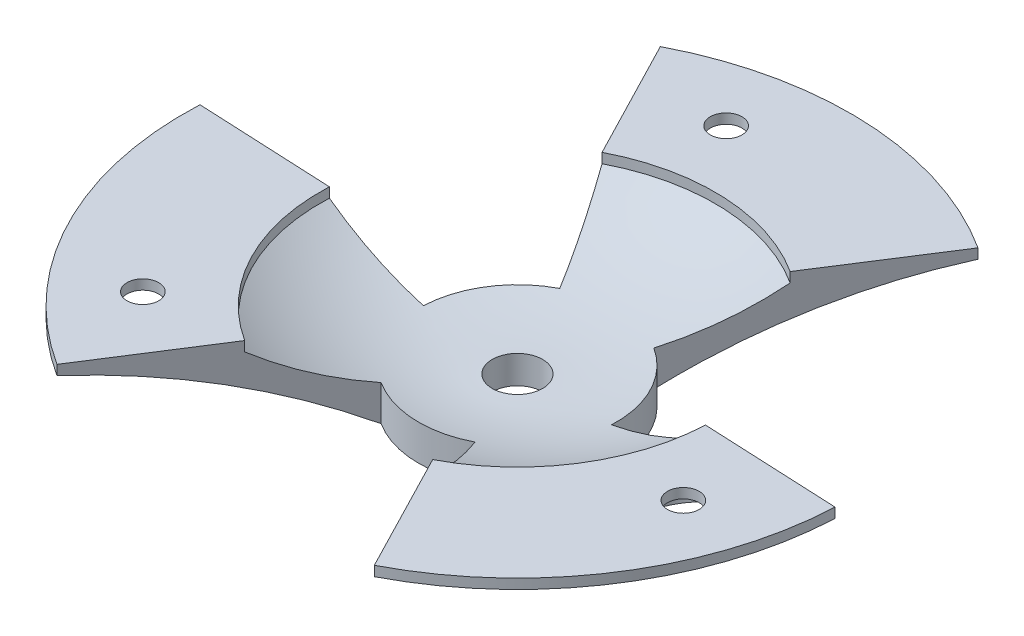
from build123d import *

# Parameters (mm, degrees)
SKETCH6_R               = 1.6
CUT_EXTRUDE3_DEPTH      = 25.4
F_1_4_20_TAPPED_HOLE2_D = 5.1054
SKETCH20_R              = 4
CUT_EXTRUDE4_DEPTH      = 7.81


with BuildPart() as part:
    # Sketch1 → Revolve3 (revolve)
    with BuildSketch(Plane.XY, mode=Mode.PRIVATE) as revolve3_sk:
        with BuildLine():
            Line((12.463542917, 0), (22.464939564, 0))
            Line((22.464939564, 0), (22.464939564, 3))
            ThreePointArc((22.464939564, 3), (12.055156212, 3.701585346), (2.464939564, 7.810545811))
            Line((2.464939564, 7.810545811), (2.464939564, 8.810545811))
            Line((2.464939564, 8.810545811), (-11.305060436, 8.810545811))
            Line((-11.305060436, 8.810545811), (-11.305060436, 7.810545811))
            ThreePointArc((-11.305060436, 7.810545811), (0.993128192, 5.164789847), (12.463542917, 0))
        make_face()
    revolve(revolve3_sk.sketch.rotate(Axis((22.464939564, 0, 0), (0, 1, 0)), 270), axis=Axis((22.464939564, 0, 0), (0, 1, 0)))

    # Sketch6 → Cut-Extrude3 (cut)
    with BuildSketch(Plane(origin=(0, 0, 0), x_dir=(-1, 0, 0), z_dir=(0, -1, 0))):
        with Locations(Location((-2.240445209, -17.721228176, 0), (0, 0, 90))):
            Circle(SKETCH6_R)
        with Locations(Location((-47.924220529, -8.654311802, 0), (0, 0, 90))):
            Circle(SKETCH6_R)
        with Locations(Location((-17.230152955, 26.375539978, 0), (0, 0, 90))):
            Circle(SKETCH6_R)
        with BuildLine():
            Line((-17.074884782, -8.424681994), (-2.715259327, -30.868846833))
            ThreePointArc((-2.715259327, -30.868846833), (-20.776195295, -36.607153906), (-39.28873242, -32.556037354))
            Line((-39.28873242, -32.556037354), (-27.060394573, -8.883116036))
            ThreePointArc((-27.060394573, -8.883116036), (-22.006259237, -9.990874316), (-17.074884782, -8.424681994))
        make_face()
        with BuildLine():
            Line((-32.455682979, -0.461498547), (-58.753919723, -1.676282828))
            Line((-58.753919723, -1.676282828), (-59.072986342, -1.669301437))
            ThreePointArc((-59.072986342, -1.669301437), (-55.012037933, 16.841082029), (-42.247399134, 30.847851619))
            Line((-42.247399134, 30.847851619), (-27.860216814, 8.421339739))
            Line((-27.860216814, 8.421339739), (-27.865844062, 8.417729237))
            ThreePointArc((-27.865844062, 8.417729237), (-31.349526098, 4.592608955), (-32.455682979, -0.461498547))
        make_face()
        with BuildLine():
            Line((-17.869237322, 8.882986874), (-5.772152998, 32.265320109))
            Line((-5.772152998, 32.265320109), (-5.606573626, 32.538149211))
            ThreePointArc((-5.606573626, 32.538149211), (8.393414485, 19.766072993), (14.141313375, 1.708186727))
            Line((14.141313375, 1.708186727), (-12.474206792, 0.46177729))
            Line((-12.474206792, 0.46177729), (-12.474519954, 0.46845588))
            ThreePointArc((-12.474519954, 0.46845588), (-14.045330272, 5.397973163), (-17.869237322, 8.882986874))
        make_face()
    extrude(amount=-CUT_EXTRUDE3_DEPTH, mode=Mode.SUBTRACT)

    # 1/4-20 Tapped Hole2 (through all)
    with Locations(Plane(origin=(0, 0, 0), x_dir=(-1, 0, 0), z_dir=(0, -1, 0))):
        with Locations((-22.464939564, 0)):
            Hole(F_1_4_20_TAPPED_HOLE2_D / 2)

    # Sketch20 → Cut-Extrude4 (cut)
    with BuildSketch(Plane(origin=(0, 0, 0), x_dir=(1, 0, 0), z_dir=(0, 1, 0))):
        with Locations(Location((2.240445209, -17.721228176, 0), (0, 0, 135.127097567))):
            Circle(SKETCH20_R)
        with Locations(Location((17.230152955, 26.375539978, 0), (0, 0, 135.575274994))):
            Circle(SKETCH20_R)
        with Locations(Location((47.924220529, -8.654311802, 0), (0, 0, 136.896542352))):
            Circle(SKETCH20_R)
    extrude(amount=CUT_EXTRUDE4_DEPTH, mode=Mode.SUBTRACT)


solid = part.part
